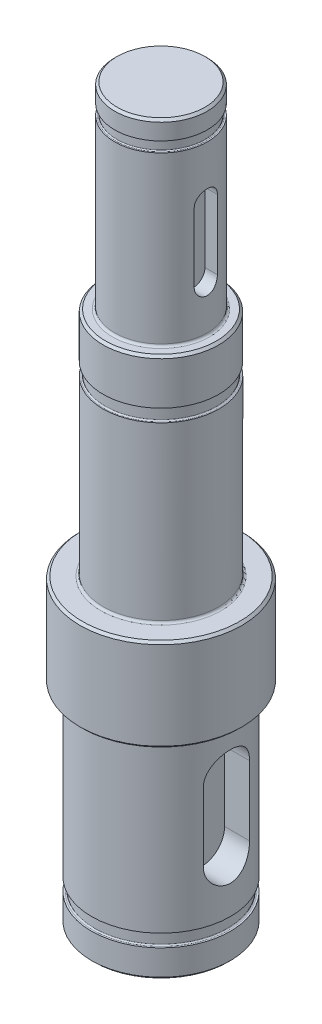
from build123d import *

# Parameters (mm, degrees)
CHAMFER1_SIZE      = 0.2
CHAMFER2_SIZE      = 0.2
FILLET1_R          = 0.2
CUT_EXTRUDE1_DEPTH = 65.251459127
CUT_EXTRUDE2_DEPTH = 65.140782658


with BuildPart() as part:
    # Sketch1 → Revolve1 (revolve)
    with BuildSketch(Plane(origin=(0, 0, 0), x_dir=(0, 0, -1), z_dir=(1, 0, 0)), mode=Mode.PRIVATE) as revolve1_sk:
        Polygon((0, 0), (0, -63), (6, -63), (6, -45), (7, -45), (7, -37), (5, -37), (5, -17), (4, -17), (4, 0), align=None)
    revolve(revolve1_sk.sketch.rotate(Axis((0, 27.897765143, 0), (0, -1, 0)), 180), axis=Axis((0, 27.897765143, 0), (0, -1, 0)))

    # Sketch3 → Groove for BS 3673 P4 - S012M, External Circlip1 (revolve, cut)
    with BuildSketch(Plane(origin=(0, 27.897765143, 0), x_dir=(0, 0, 1), z_dir=(-1, 0, 0))):
        with BuildLine():
            Line((5.86, -88.497765143), (7.2, -88.497765143))
            Line((7.2, -88.497765143), (7.2, -87.397765143))
            Line((7.2, -87.397765143), (5.86, -87.397765143))
            ThreePointArc((5.86, -87.397765143), (5.782218254, -87.429983397), (5.75, -87.507765143))
            Line((5.75, -87.507765143), (5.75, -88.387765143))
            ThreePointArc((5.75, -88.387765143), (5.782218254, -88.465546889), (5.86, -88.497765143))
        make_face()
    revolve(axis=Axis((0, -22.102234857, 0), (0, 1, 0)), mode=Mode.SUBTRACT)

    # Sketch5 → Groove for BS 3673 P4 - S010M, External Circlip1 (revolve, cut)
    with BuildSketch(Plane(origin=(0, 27.897765143, 0), x_dir=(0, 0, 1), z_dir=(-1, 0, 0))):
        with BuildLine():
            Line((4.91, -49.897765143), (6, -49.897765143))
            Line((6, -49.897765143), (6, -48.797765143))
            Line((6, -48.797765143), (4.91, -48.797765143))
            ThreePointArc((4.91, -48.797765143), (4.832218254, -48.829983397), (4.8, -48.907765143))
            Line((4.8, -48.907765143), (4.8, -49.787765143))
            ThreePointArc((4.8, -49.787765143), (4.832218254, -49.865546889), (4.91, -49.897765143))
        make_face()
    revolve(axis=Axis((0, -22.102234857, 0), (0, 1, 0)), mode=Mode.SUBTRACT)

    # Sketch7 → Groove for BS 3673 P4 - S008M, External Circlip1 (revolve, cut)
    with BuildSketch(Plane(origin=(0, 27.897765143, 0), x_dir=(0, 0, 1), z_dir=(-1, 0, 0))):
        with BuildLine():
            Line((3.89, -30.397765143), (4.8, -30.397765143))
            Line((4.8, -30.397765143), (4.8, -29.497765143))
            Line((4.8, -29.497765143), (3.89, -29.497765143))
            ThreePointArc((3.89, -29.497765143), (3.82636039, -29.524125532), (3.8, -29.587765143))
            Line((3.8, -29.587765143), (3.8, -30.307765143))
            ThreePointArc((3.8, -30.307765143), (3.82636039, -30.371404753), (3.89, -30.397765143))
        make_face()
    revolve(axis=Axis((0, -16.204997178, 0), (0, 1, 0)), mode=Mode.SUBTRACT)

    # Chamfer1
    chamfer1_edges = [part.edges().sort_by_distance(p)[0] for p in [
        (0, -37, -7),
    ]]
    chamfer(chamfer1_edges, length=CHAMFER1_SIZE)

    # Chamfer2
    chamfer2_edges = [part.edges().sort_by_distance(p)[0] for p in [
        (0, -45, -7),
        (0, -63, -6),
        (0, 0, -4),
        (0, -17, -5),
    ]]
    chamfer(chamfer2_edges, length=CHAMFER2_SIZE)

    # Fillet1
    fillet1_edges = [part.edges().sort_by_distance(p)[0] for p in [
        (0, -45, -6),
        (0, -17, -4),
        (0, -37, -5),
    ]]
    fillet(fillet1_edges, radius=FILLET1_R)

    # Sketch8 → Cut-Extrude1 (cut, through all)
    with BuildSketch(Plane(origin=(3.5, 0, 0), x_dir=(0, 0, -1), z_dir=(1, 0, 0))):
        with BuildLine():
            Line((2, -49), (2, -55))
            ThreePointArc((2, -55), (0, -57), (-2, -55))
            Line((-2, -55), (-2, -49))
            ThreePointArc((-2, -49), (0, -47), (2, -49))
        make_face()
    extrude(amount=CUT_EXTRUDE1_DEPTH, mode=Mode.SUBTRACT)

    # Sketch9 → Cut-Extrude2 (cut, through all)
    with BuildSketch(Plane(origin=(2.8, 0, 0), x_dir=(0, 0, -1), z_dir=(1, 0, 0))):
        with BuildLine():
            Line((1, -7), (1, -13))
            ThreePointArc((1, -13), (0, -14), (-1, -13))
            Line((-1, -13), (-1, -7))
            ThreePointArc((-1, -7), (0, -6), (1, -7))
        make_face()
    extrude(amount=CUT_EXTRUDE2_DEPTH, mode=Mode.SUBTRACT)


solid = part.part
